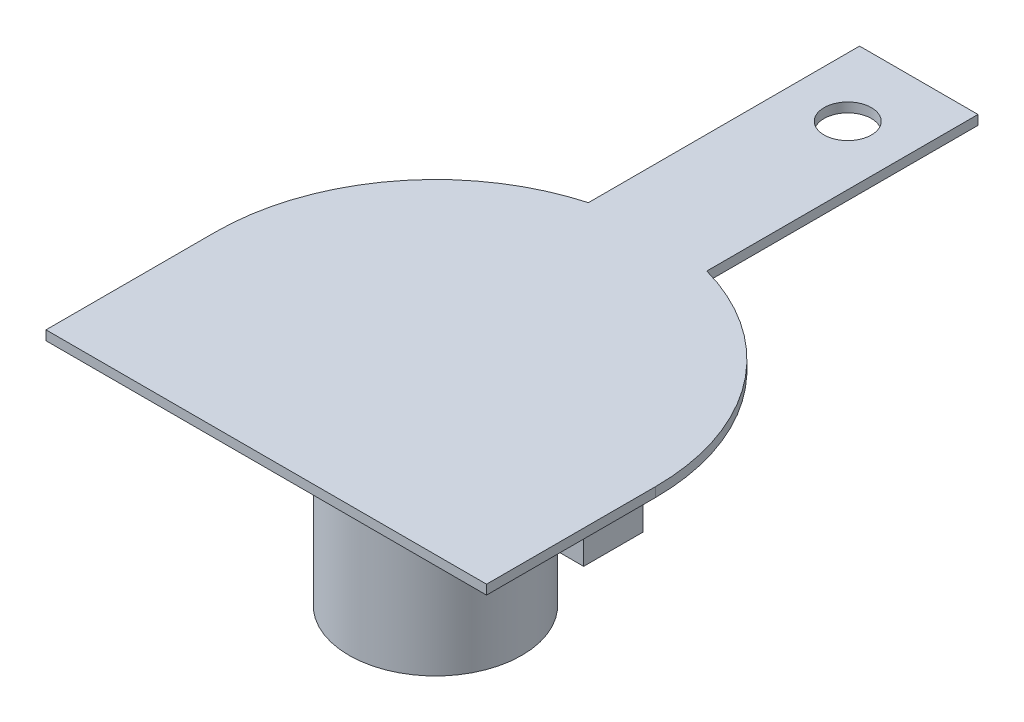
from build123d import *

# Parameters (mm, degrees)
EXTRUDE_1_DEPTH     = 0.4
SKETCH_3_W          = 2.5
SKETCH_3_H          = 2.5
EXTRUDE_2_DEPTH     = 1.5
CUT_EXTRUDE_1_REACH = 27.763
SKETCH_5_R          = 1
EXTRUDE_START       = -0.4
SKETCH_6_R          = 3.65
EXTRUDE_3_DEPTH     = 9


with BuildPart() as part:
    # 草图1 → 凸台-拉伸1 (new body)
    with BuildSketch(Plane(origin=(0, 0, 0), x_dir=(1, 0, 0), z_dir=(0, 1, 0))):
        with BuildLine():
            Line((-2.5, 12.528839135), (-2.5, 23.978839135))
            Line((-2.5, 23.978839135), (2.5, 23.978839135))
            Line((2.5, 23.978839135), (2.5, 12.528839135))
            ThreePointArc((2.5, 12.528839135), (7.407428704, 9.194327232), (9.3, 3.571160865))
            Line((9.3, 3.571160865), (9.3, -3.571160865))
            Line((9.3, -3.571160865), (-9.3, -3.571160865))
            Line((-9.3, -3.571160865), (-9.3, 3.571160865))
            ThreePointArc((-9.3, 3.571160865), (-7.407428704, 9.194327232), (-2.5, 12.528839135))
        make_face()
    extrude(amount=EXTRUDE_1_DEPTH)

    # 草图3 → 凸台-拉伸2 (add)
    with BuildSketch(Plane.XZ):
        with Locations((7.55, -2.278839135)):
            Rectangle(SKETCH_3_W, SKETCH_3_H)
        with Locations((-7.55, -2.278839135)):
            Rectangle(SKETCH_3_W, SKETCH_3_H)
    extrude(amount=EXTRUDE_2_DEPTH)

    # 草图5 → 切除-拉伸1 (cut, up to next)
    with BuildSketch(Plane.XZ, mode=Mode.PRIVATE) as cut_extrude_1_sk1:
        with Locations(Location((0, -20.978839135, 0), (0, 0, 270))):
            Circle(SKETCH_5_R)
    cut_extrude_1_tool1 = extrude(cut_extrude_1_sk1.sketch, amount=-CUT_EXTRUDE_1_REACH, mode=Mode.PRIVATE) & part.part
    add(cut_extrude_1_tool1.solids().sort_by_distance((0, 0, -20.978839))[0], mode=Mode.SUBTRACT)

    # 草图6 → 凸台-拉伸3 (add)
    with BuildSketch(Plane.XZ.offset(EXTRUDE_START)):
        with Locations(Location((0, -3.571160865, 0), (0, 0, 270))):
            Circle(SKETCH_6_R)
    extrude(amount=EXTRUDE_3_DEPTH)


solid = part.part
